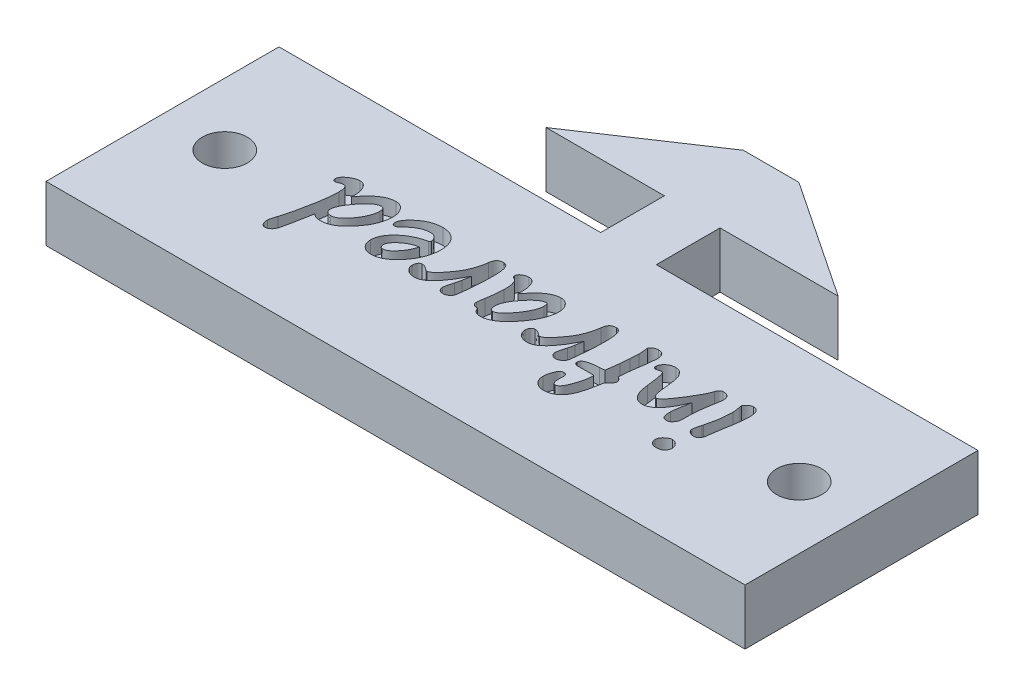
from build123d import *

# Parameters (mm, degrees)
BOSS_EXTRUDE1_DEPTH = 3.5814
SKETCH2_R           = 1.45
CUT_EXTRUDE1_DEPTH  = 29.456614801
CUT_EXTRUDE3_DEPTH  = 1


with BuildPart() as part:
    # Sketch1 → Boss-Extrude1 (new body)
    with BuildSketch(Plane(origin=(0, 0, 0), x_dir=(1, 0, 0), z_dir=(0, 1, 0))):
        Polygon((-22.5, -17.05), (22.5, -17.05), (22.5, -2.05), (1.7907, -2.05), (1.7907, 2.05), (9.398, 2.05), (1.7907, 7.13), (-1.7907, 7.13), (-9.398, 2.05), (-1.7907, 2.05), (-1.7907, -2.05), (-22.5, -2.05), align=None)
    extrude(amount=BOSS_EXTRUDE1_DEPTH)

    # Sketch2 → Cut-Extrude1 (cut, through all)
    with BuildSketch(Plane(origin=(0, 3.5814, 0), x_dir=(1, 0, 0), z_dir=(0, 1, 0))):
        with Locations(Location((-18.49, -9.55, 0), (0, 0, 270))):
            Circle(SKETCH2_R)
        with Locations(Location((18.49, -9.55, 0), (0, 0, 270))):
            Circle(SKETCH2_R)
    extrude(amount=-CUT_EXTRUDE1_DEPTH, mode=Mode.SUBTRACT)

    # infraredText → Cut-Extrude3 (cut)
    # profile 1 of 9: a face of its own
    with BuildSketch(Plane(origin=(0, 3.5814, 0), x_dir=(1, 0, 0), z_dir=(0, 1, 0))):
        with BuildLine():
            add(Edge.make_bspline(
                [(-11.806110015, -8.070633535), (-11.771150194, -8.023362866), (-11.702854527, -7.93101737), (-11.598127027, -7.798755117), (-11.492202987, -7.676748346), (-11.386490875, -7.563620089), (-11.282128049, -7.458022875), (-11.176053303, -7.363116004), (-11.07028154, -7.276144398), (-10.964409634, -7.198366878), (-10.857618181, -7.131022331), (-10.752364393, -7.070920318), (-10.646197147, -7.020465267), (-10.539597929, -6.980511925), (-10.433149615, -6.948227767), (-10.326862261, -6.9251547), (-10.220122375, -6.911240358), (-10.149026068, -6.909244173), (-10.11344185, -6.908245068)],
                knots=[0, 0, 0, 0, 1.324976436, 2.588404326, 3.800907731, 4.96509339, 6.077533696, 7.145523712, 8.171201392, 9.16285322, 10.103788344, 11.015030626, 11.893091768, 12.749564708, 13.578348318, 14.397906085, 15.198140357, 16, 16, 16, 16], degree=3))
            add(Edge.make_bspline(
                [(-10.11344185, -6.908245068), (-10.085516258, -6.908771632), (-10.030601187, -6.909807109), (-9.950535476, -6.924279286), (-9.873973719, -6.944989114), (-9.801643126, -6.97492826), (-9.733705417, -7.013500855), (-9.671186878, -7.061766096), (-9.610606933, -7.116135272), (-9.557217199, -7.181003042), (-9.506432574, -7.250352929), (-9.465037113, -7.326958039), (-9.428064309, -7.406609037), (-9.398031153, -7.491135448), (-9.375070335, -7.580545352), (-9.359375038, -7.674753608), (-9.347843503, -7.773189748), (-9.347180428, -7.840361621), (-9.346841852, -7.874660604)],
                knots=[0, 0, 0, 0, 0.969388154, 1.906280828, 2.819060712, 3.722358151, 4.61973858, 5.525774951, 6.46319642, 7.442312715, 8.439918134, 9.4464254, 10.46248833, 11.490491446, 12.559553965, 13.666646494, 14.808554106, 16, 16, 16, 16], degree=3))
            add(Edge.make_bspline(
                [(-9.346841852, -7.874660604), (-9.348813298, -7.945872655), (-9.352767966, -8.08872214), (-9.387053324, -8.302433097), (-9.442155863, -8.51552078), (-9.518834411, -8.728468503), (-9.615860488, -8.94173396), (-9.737425958, -9.153113673), (-9.878808141, -9.364748236), (-10.038945548, -9.571226003), (-10.208566694, -9.765749367), (-10.383401046, -9.937576011), (-10.559143824, -10.083008898), (-10.73476902, -10.203198883), (-10.911720728, -10.297153625), (-11.090060217, -10.362938909), (-11.269118933, -10.404545897), (-11.389294362, -10.410002638), (-11.44874761, -10.412702199)],
                knots=[0, 0, 0, 0, 0.958699336, 1.92312542, 2.907531197, 3.919813922, 4.967853069, 6.059222458, 7.200454383, 8.393590881, 9.576352525, 10.674375138, 11.691626039, 12.645071656, 13.536397169, 14.382483164, 15.199781262, 16, 16, 16, 16], degree=3))
            add(Edge.make_bspline(
                [(-11.44874761, -10.412702199), (-11.481752109, -10.412255668), (-11.54535286, -10.411395187), (-11.636989841, -10.401866208), (-11.721077206, -10.385307405), (-11.798323419, -10.363875416), (-11.867819206, -10.334801922), (-11.930145811, -10.300288302), (-11.985054707, -10.258644145), (-12.015663246, -10.225530524), (-12.030902495, -10.209044055)],
                knots=[0, 0, 0, 0, 1.244307737, 2.397821757, 3.468262062, 4.473437161, 5.415329021, 6.302038564, 7.154626184, 8, 8, 8, 8], degree=3))
            add(Edge.make_bspline(
                [(-12.030902495, -10.209044055), (-12.048230694, -10.294534564), (-12.081190417, -10.457144867), (-12.127521984, -10.688620678), (-12.167213494, -10.895030974), (-12.20385604, -11.075940831), (-12.231833648, -11.231850455), (-12.256018665, -11.362461821), (-12.275929581, -11.467270988), (-12.285298272, -11.529275457), (-12.289317783, -11.555877634)],
                knots=[0, 0, 0, 0, 1.526449126, 2.903437537, 4.130980214, 5.20466225, 6.133387332, 6.902732848, 7.529232388, 8, 8, 8, 8], degree=3))
            add(Edge.make_bspline(
                [(-12.289317783, -11.555877634), (-12.297330356, -11.595903142), (-12.31259127, -11.67213655), (-12.334374243, -11.781532658), (-12.356422879, -11.880122552), (-12.377956429, -11.968325493), (-12.396277354, -12.046558345), (-12.416192996, -12.113442373), (-12.43258202, -12.170660218), (-12.455697771, -12.231249129), (-12.485523776, -12.297347972), (-12.53118336, -12.366429928), (-12.585775441, -12.425978792), (-12.647454546, -12.474668514), (-12.710483262, -12.513286405), (-12.770422943, -12.54139891), (-12.825783605, -12.560757872), (-12.862054381, -12.56334288), (-12.879157881, -12.564561842)],
                knots=[0, 0, 0, 0, 1.553536891, 2.958898393, 4.245068746, 5.39787912, 6.414667805, 7.301890869, 8.05363876, 8.678390636, 9.768764809, 10.806445872, 11.815610368, 12.830059252, 13.787335911, 14.621496536, 15.349966074, 16, 16, 16, 16], degree=3))
            add(Edge.make_bspline(
                [(-12.879157881, -12.564561842), (-12.905341937, -12.563068149), (-12.955930801, -12.560182262), (-13.026784985, -12.532876541), (-13.087363367, -12.487988858), (-13.135990793, -12.426035661), (-13.173816032, -12.35204176), (-13.200586499, -12.267930318), (-13.216993441, -12.175172979), (-13.219097384, -12.110244777), (-13.220189208, -12.076550816)],
                knots=[0, 0, 0, 0, 0.93919978, 1.814579444, 2.688136663, 3.622232059, 4.62217955, 5.664461456, 6.787991285, 8, 8, 8, 8], degree=3))
            add(Edge.make_bspline(
                [(-13.220189208, -12.076550816), (-13.219751995, -12.06692145), (-13.218709953, -12.043971093), (-13.210863192, -12.004676468), (-13.200429379, -11.95471565), (-13.185903124, -11.893783264), (-13.166395145, -11.822211264), (-13.143636471, -11.739410373), (-13.115227984, -11.646156365), (-13.095291454, -11.580217562), (-13.084737329, -11.545310466)],
                knots=[0, 0, 0, 0, 0.420801042, 1.002925227, 1.746803402, 2.653176078, 3.73952945, 4.989144469, 6.406094463, 8, 8, 8, 8], degree=3))
            add(Edge.make_bspline(
                [(-13.084737329, -11.545310466), (-13.066342324, -11.484512199), (-13.028662255, -11.359973883), (-12.973605936, -11.168070102), (-12.921338566, -10.966383276), (-12.869235408, -10.755716725), (-12.818577965, -10.535966284), (-12.768492501, -10.307021886), (-12.719660795, -10.068731139), (-12.67209151, -9.824799279), (-12.628965782, -9.582246241), (-12.588854252, -9.349326528), (-12.556505605, -9.128883543), (-12.528964073, -8.921772363), (-12.509353066, -8.727225543), (-12.49316215, -8.545732063), (-12.484352227, -8.376850974), (-12.483038191, -8.268536133), (-12.482408759, -8.216652583)],
                knots=[0, 0, 0, 0, 0.898980173, 1.841458341, 2.825263159, 3.847482305, 4.91272706, 6.016770872, 7.164208838, 8.355201615, 9.533956712, 10.650781139, 11.699969597, 12.687056986, 13.607440684, 14.467039357, 15.265701345, 16, 16, 16, 16], degree=3))
            add(Edge.make_bspline(
                [(-12.482408759, -8.216652583), (-12.483005189, -8.172106444), (-12.484123143, -8.088608627), (-12.495771947, -7.972403457), (-12.512680871, -7.873112246), (-12.53896284, -7.79203335), (-12.572608916, -7.727348026), (-12.61519447, -7.680564933), (-12.667156654, -7.650365468), (-12.705219208, -7.647484403), (-12.724492969, -7.646025517)],
                knots=[0, 0, 0, 0, 1.570962073, 2.944630182, 4.116766624, 5.117064123, 5.9411411, 6.668474312, 7.325754419, 8, 8, 8, 8], degree=3))
            add(Edge.make_bspline(
                [(-12.724492969, -7.646025517), (-12.745673338, -7.646811231), (-12.788972507, -7.648417473), (-12.854792674, -7.660456618), (-12.922293839, -7.680840607), (-12.966740293, -7.69970979), (-12.989632818, -7.709428524)],
                knots=[0, 0, 0, 0, 0.925175566, 1.89134257, 2.913918031, 4, 4, 4, 4], degree=3))
            add(Edge.make_bspline(
                [(-12.989632818, -7.709428524), (-13.011312861, -7.718345995), (-13.05051594, -7.73447107), (-13.105069036, -7.752768744), (-13.148837317, -7.7657778), (-13.175302259, -7.768030233), (-13.186566401, -7.768988925)],
                knots=[0, 0, 0, 0, 1.360770826, 2.460622662, 3.344802459, 4, 4, 4, 4], degree=3))
            add(Edge.make_bspline(
                [(-13.186566401, -7.768988925), (-13.198797534, -7.768511456), (-13.22200423, -7.767605531), (-13.254426065, -7.758791584), (-13.28260791, -7.744313228), (-13.304721924, -7.722399989), (-13.322544747, -7.695686152), (-13.335301959, -7.663015027), (-13.341106505, -7.624451858), (-13.342447158, -7.59704444), (-13.343152616, -7.582622509)],
                knots=[0, 0, 0, 0, 1.053201094, 1.998287302, 2.875942799, 3.75533623, 4.65192373, 5.631907346, 6.753896922, 8, 8, 8, 8], degree=3))
            add(Edge.make_bspline(
                [(-13.343152616, -7.582622509), (-13.342321512, -7.563612321), (-13.3406459, -7.525285351), (-13.323604784, -7.468462685), (-13.298738955, -7.41130624), (-13.262600877, -7.354747468), (-13.216765102, -7.298756347), (-13.161193924, -7.242804116), (-13.096084521, -7.186071213), (-12.996766773, -7.114505906), (-12.869297981, -7.034480036), (-12.714172492, -6.961496613), (-12.561296591, -6.917816768), (-12.460240273, -6.9113672), (-12.411320539, -6.908245068)],
                knots=[0, 0, 0, 0, 0.55329444, 1.115512297, 1.717989145, 2.368749697, 3.066331064, 3.826219108, 4.667472561, 5.583269178, 7.395909717, 9.051658431, 10.57275539, 12, 12, 12, 12], degree=3))
            add(Edge.make_bspline(
                [(-12.411320539, -6.908245068), (-12.386241239, -6.908963272), (-12.33679898, -6.910379166), (-12.265349296, -6.927720068), (-12.197882592, -6.953755538), (-12.134562961, -6.990565111), (-12.077020446, -7.039427729), (-12.023658949, -7.097990691), (-11.974480966, -7.166568543), (-11.931276933, -7.245397391), (-11.891729975, -7.330788827), (-11.860624833, -7.422847052), (-11.834310999, -7.518975447), (-11.815323088, -7.620180027), (-11.80278299, -7.726102452), (-11.797649162, -7.836796678), (-11.796798108, -7.952301228), (-11.802962016, -8.030629915), (-11.806110015, -8.070633535)],
                knots=[0, 0, 0, 0, 0.819758064, 1.616101291, 2.393219002, 3.182903956, 4.002057948, 4.855734939, 5.772597315, 6.758710504, 7.795981571, 8.850762113, 9.93713835, 11.058198046, 12.219928082, 13.427710693, 14.686293749, 16, 16, 16, 16], degree=3))
        make_face()
        with BuildLine():
            add(Edge.make_bspline(
                [(-11.430495229, -9.797885159), (-11.394767892, -9.795614586), (-11.321818285, -9.790978432), (-11.212439127, -9.75956455), (-11.103077199, -9.707073227), (-10.992331572, -9.63545877), (-10.881584063, -9.542492422), (-10.769287875, -9.430266331), (-10.654950209, -9.298598118), (-10.544030804, -9.149151247), (-10.437230446, -8.993194471), (-10.34443138, -8.835009788), (-10.263617063, -8.681785756), (-10.199281791, -8.530864389), (-10.147274143, -8.38422644), (-10.112178017, -8.239963691), (-10.08820273, -8.099616689), (-10.085800234, -8.006683815), (-10.084622301, -7.96111925)],
                knots=[0, 0, 0, 0, 0.705379144, 1.440273328, 2.22955745, 3.094346001, 4.037630123, 5.079521489, 6.227076151, 7.477924592, 8.75304302, 9.957970022, 11.097814732, 12.171463362, 13.195409933, 14.166271496, 15.100931247, 16, 16, 16, 16], degree=3))
            add(Edge.make_bspline(
                [(-10.084622301, -7.96111925), (-10.08536663, -7.936426123), (-10.086766408, -7.889988437), (-10.096751293, -7.825155873), (-10.114779841, -7.769919589), (-10.141001886, -7.724712008), (-10.17446373, -7.688570313), (-10.215908256, -7.663065676), (-10.264904844, -7.648356907), (-10.299703127, -7.646830669), (-10.318060646, -7.646025517)],
                knots=[0, 0, 0, 0, 1.326939189, 2.495430678, 3.513138019, 4.431082101, 5.283269924, 6.1333699, 7.015276214, 8, 8, 8, 8], degree=3))
            add(Edge.make_bspline(
                [(-10.318060646, -7.646025517), (-10.351947081, -7.648084308), (-10.422884517, -7.652394157), (-10.529540318, -7.689623218), (-10.640923648, -7.744946419), (-10.756376671, -7.823363208), (-10.876450334, -7.923224506), (-11.001178331, -8.045095746), (-11.130685988, -8.188831403), (-11.260681695, -8.349445706), (-11.38504281, -8.515976611), (-11.497132275, -8.677913535), (-11.591174585, -8.831353957), (-11.669155806, -8.974882448), (-11.729688583, -9.109593611), (-11.771940381, -9.235752592), (-11.800405435, -9.352489133), (-11.804277657, -9.427895615), (-11.806110015, -9.463578393)],
                knots=[0, 0, 0, 0, 0.657273412, 1.375927919, 2.175000218, 3.072880042, 4.081247454, 5.208352828, 6.460100899, 7.840798174, 9.224145718, 10.500287903, 11.6683947, 12.721270525, 13.674510839, 14.534848866, 15.306682107, 16, 16, 16, 16], degree=3))
            add(Edge.make_bspline(
                [(-11.806110015, -9.463578393), (-11.804771976, -9.4839102), (-11.802098898, -9.524528221), (-11.781353957, -9.584076821), (-11.748172886, -9.640857631), (-11.703304735, -9.694072492), (-11.648313271, -9.74080069), (-11.582248146, -9.773332234), (-11.508958064, -9.794492874), (-11.457228293, -9.796729374), (-11.430495229, -9.797885159)],
                knots=[0, 0, 0, 0, 0.87516286, 1.748363225, 2.68852472, 3.69791186, 4.737350443, 5.77467793, 6.849991473, 8, 8, 8, 8], degree=3))
        make_face(mode=Mode.SUBTRACT)
    # profile 2 of 9: a face of its own
    with BuildSketch(Plane(origin=(0, 3.5814, 0), x_dir=(1, 0, 0), z_dir=(0, 1, 0))):
        with BuildLine():
            add(Edge.make_bspline(
                [(-8.977951628, -8.107138297), (-8.976227075, -8.078444662), (-8.972630106, -8.018597212), (-8.943166978, -7.928309176), (-8.898029165, -7.834481662), (-8.836167649, -7.736215713), (-8.754889499, -7.635498256), (-8.657388302, -7.52989721), (-8.54305139, -7.419306926), (-8.412609347, -7.308614326), (-8.272566501, -7.200494236), (-8.123447174, -7.107045582), (-7.970727482, -7.025949554), (-7.812942862, -6.960913671), (-7.65041074, -6.90939106), (-7.483538999, -6.873042498), (-7.31178336, -6.851513319), (-7.196003616, -6.848360672), (-7.137343113, -6.846763364)],
                knots=[0, 0, 0, 0, 0.57554803, 1.200443268, 1.891164434, 2.665922844, 3.527072402, 4.487897783, 5.552645211, 6.720875868, 7.92405451, 9.103938409, 10.252243972, 11.394531414, 12.527960044, 13.673865764, 14.821450097, 16, 16, 16, 16], degree=3))
            add(Edge.make_bspline(
                [(-7.137343113, -6.846763364), (-7.0931031, -6.847896594), (-7.006554963, -6.850113567), (-6.880447611, -6.866637815), (-6.761456435, -6.893615995), (-6.649507323, -6.930373785), (-6.545658654, -6.980606335), (-6.448343074, -7.039884708), (-6.358095377, -7.110535644), (-6.276933489, -7.192439041), (-6.203268548, -7.283339051), (-6.138931773, -7.383082139), (-6.085259772, -7.491586948), (-6.040232865, -7.60775963), (-6.007632439, -7.733340577), (-5.9822536, -7.866756027), (-5.967998643, -8.008842367), (-5.96624761, -8.106147334), (-5.965348129, -8.15613153)],
                knots=[0, 0, 0, 0, 1.066413057, 2.086257618, 3.060152985, 4.004972127, 4.920084507, 5.835034041, 6.747798638, 7.67584611, 8.609081286, 9.564190282, 10.530929413, 11.523105385, 12.562487588, 13.654226254, 14.795008941, 16, 16, 16, 16], degree=3))
            add(Edge.make_bspline(
                [(-5.965348129, -8.15613153), (-5.966981982, -8.231500751), (-5.970235748, -8.381596168), (-6.00308922, -8.604517653), (-6.051826864, -8.824243938), (-6.124744584, -9.039613337), (-6.214440453, -9.252184733), (-6.326054259, -9.460918347), (-6.458259405, -9.665258145), (-6.606788718, -9.863112113), (-6.766628671, -10.0468006), (-6.931249656, -10.210382761), (-7.100472587, -10.347704764), (-7.271312793, -10.461377385), (-7.446226295, -10.549127537), (-7.623599768, -10.611912269), (-7.804221329, -10.651445203), (-7.925843778, -10.656236929), (-7.98655915, -10.658629016)],
                knots=[0, 0, 0, 0, 1.031231157, 2.05366421, 3.078941494, 4.109053673, 5.161976755, 6.234828808, 7.34516123, 8.491204526, 9.619218471, 10.676404711, 11.664457494, 12.598343919, 13.480657219, 14.336215279, 15.169418901, 16, 16, 16, 16], degree=3))
            add(Edge.make_bspline(
                [(-7.98655915, -10.658629016), (-8.016045305, -10.657819098), (-8.07392827, -10.656229185), (-8.158630141, -10.645881346), (-8.238897344, -10.627221466), (-8.315134034, -10.602646217), (-8.386763715, -10.569823906), (-8.453312661, -10.528848833), (-8.515984015, -10.481858745), (-8.573607342, -10.428046362), (-8.624890489, -10.368731142), (-8.67014791, -10.306525639), (-8.708391807, -10.241288953), (-8.738446897, -10.172943013), (-8.764449979, -10.102397629), (-8.78135669, -10.028476557), (-8.79089459, -9.951839561), (-8.792627064, -9.900060901), (-8.793506516, -9.873776637)],
                knots=[0, 0, 0, 0, 1.123949543, 2.206375635, 3.245620512, 4.260718056, 5.254683183, 6.24059744, 7.234112844, 8.235841109, 9.239352339, 10.2183675, 11.164574431, 12.115101067, 13.06091432, 14.026060516, 14.997974354, 16, 16, 16, 16], degree=3))
            add(Edge.make_bspline(
                [(-8.793506516, -9.873776637), (-8.791740503, -9.826603125), (-8.788196226, -9.731928825), (-8.762547819, -9.591179995), (-8.719648002, -9.452353582), (-8.659502013, -9.315693879), (-8.582763131, -9.18034593), (-8.489474695, -9.046610456), (-8.377578355, -8.916033876), (-8.251909659, -8.787152321), (-8.112478371, -8.664282162), (-7.96253411, -8.549546526), (-7.802250228, -8.445821914), (-7.633026188, -8.351318138), (-7.453627734, -8.267843582), (-7.265157016, -8.194262932), (-7.067598062, -8.128740513), (-6.931064847, -8.095315674), (-6.861636096, -8.078318748)],
                knots=[0, 0, 0, 0, 0.800803191, 1.607162089, 2.420693954, 3.263201909, 4.13728089, 5.058926231, 6.02735895, 7.054002529, 8.113358597, 9.180223585, 10.257060199, 11.352407999, 12.468942304, 13.613976215, 14.786678748, 16, 16, 16, 16], degree=3))
            add(Edge.make_bspline(
                [(-6.861636096, -8.078318748), (-6.847126057, -8.073779508), (-6.819932842, -8.065272533), (-6.786915524, -8.039109971), (-6.767011554, -8.002669965), (-6.76543922, -7.975462884), (-6.764610282, -7.96111925)],
                knots=[0, 0, 0, 0, 1.092953599, 2.048300673, 2.971059712, 4, 4, 4, 4], degree=3))
            add(Edge.make_bspline(
                [(-6.764610282, -7.96111925), (-6.7663779, -7.935311081), (-6.769950784, -7.88314509), (-6.796626051, -7.80600834), (-6.840928935, -7.732079496), (-6.899870058, -7.661602303), (-6.972930149, -7.599636602), (-7.060414538, -7.555271765), (-7.158992588, -7.527044612), (-7.228719553, -7.524427808), (-7.265109779, -7.523062109)],
                knots=[0, 0, 0, 0, 0.840820492, 1.699548494, 2.631031788, 3.639332869, 4.685074668, 5.731442161, 6.816048695, 8, 8, 8, 8], degree=3))
            add(Edge.make_bspline(
                [(-7.265109779, -7.523062109), (-7.318745124, -7.525103425), (-7.426934735, -7.529221032), (-7.588420914, -7.562957154), (-7.749989085, -7.614934574), (-7.910975412, -7.688762286), (-8.071163268, -7.784022281), (-8.230808554, -7.900271195), (-8.390567231, -8.036708024), (-8.491671323, -8.139632879), (-8.543737093, -8.192636292)],
                knots=[0, 0, 0, 0, 0.866839858, 1.74853109, 2.657591878, 3.607915725, 4.606351584, 5.667263571, 6.798706195, 8, 8, 8, 8], degree=3))
            add(Edge.make_bspline(
                [(-8.543737093, -8.192636292), (-8.563665042, -8.212212423), (-8.600737218, -8.24863011), (-8.661761265, -8.290295042), (-8.722446022, -8.317674605), (-8.764125867, -8.320828135), (-8.7839, -8.322324261)],
                knots=[0, 0, 0, 0, 1.194008747, 2.22122733, 3.156098407, 4, 4, 4, 4], degree=3))
            add(Edge.make_bspline(
                [(-8.7839, -8.322324261), (-8.798990762, -8.321483601), (-8.827582903, -8.319890819), (-8.868137315, -8.310768092), (-8.902216299, -8.293201201), (-8.930542645, -8.268933857), (-8.952897654, -8.238195922), (-8.966876637, -8.19959504), (-8.97685876, -8.155684879), (-8.977575267, -8.123856739), (-8.977951628, -8.107138297)],
                knots=[0, 0, 0, 0, 1.09370073, 2.072211148, 2.984766472, 3.83983899, 4.753571805, 5.700815368, 6.792301877, 8, 8, 8, 8], degree=3))
        make_face()
        with BuildLine():
            add(Edge.make_bspline(
                [(-6.822249379, -8.680647318), (-6.86465107, -8.690044971), (-6.948507511, -8.708630404), (-7.07139248, -8.745652231), (-7.190094587, -8.789634857), (-7.305314875, -8.840928923), (-7.416779264, -8.899457926), (-7.524251761, -8.96566634), (-7.627401949, -9.039448449), (-7.725968169, -9.117540447), (-7.815745308, -9.19943036), (-7.89631739, -9.279651156), (-7.963448422, -9.359309007), (-8.018941167, -9.43659098), (-8.06295445, -9.511521259), (-8.094340824, -9.585312033), (-8.113732245, -9.65759101), (-8.116075996, -9.705556258), (-8.117207771, -9.728718242)],
                knots=[0, 0, 0, 0, 1.183709009, 2.340982726, 3.495586228, 4.632831282, 5.776991368, 6.925406583, 8.071164194, 9.232776225, 10.351474417, 11.382388316, 12.330264518, 13.187804325, 13.973938698, 14.693831104, 15.369262885, 16, 16, 16, 16], degree=3))
            add(Edge.make_bspline(
                [(-8.117207771, -9.728718242), (-8.116564858, -9.746092326), (-8.115322961, -9.779653317), (-8.103024784, -9.827535002), (-8.085101395, -9.87145309), (-8.05905252, -9.910147401), (-8.026509099, -9.941666341), (-7.989497309, -9.965603675), (-7.947485921, -9.979612945), (-7.918136857, -9.981404962), (-7.902982459, -9.982330271)],
                knots=[0, 0, 0, 0, 1.123502494, 2.170235578, 3.183743803, 4.185072822, 5.168178559, 6.100719146, 7.01930572, 8, 8, 8, 8], degree=3))
            add(Edge.make_bspline(
                [(-7.902982459, -9.982330271), (-7.878845143, -9.98092039), (-7.829525379, -9.978039581), (-7.755008987, -9.957311881), (-7.679261342, -9.924374715), (-7.601614285, -9.87801635), (-7.521897389, -9.819441485), (-7.441530492, -9.746119735), (-7.357863833, -9.662007201), (-7.274968036, -9.565709474), (-7.193609696, -9.463244375), (-7.11851786, -9.356452774), (-7.051135731, -9.247543312), (-6.990854413, -9.137084432), (-6.936436918, -9.025997324), (-6.891311907, -8.912416713), (-6.852697134, -8.797608132), (-6.832369802, -8.719523513), (-6.822249379, -8.680647318)],
                knots=[0, 0, 0, 0, 0.65097919, 1.330145421, 2.07342166, 2.875282111, 3.765466824, 4.738660306, 5.808090844, 6.965785881, 8.165677898, 9.338117153, 10.486874827, 11.62008614, 12.733282582, 13.8229493, 14.916106027, 16, 16, 16, 16], degree=3))
        make_face(mode=Mode.SUBTRACT)
    # profile 3 of 9: a face of its own
    with BuildSketch(Plane(origin=(0, 3.5814, 0), x_dir=(1, 0, 0), z_dir=(0, 1, 0))):
        with BuildLine():
            Line((-3.514725831, -8.648945814), (-3.570443626, -8.753656841))
            add(Edge.make_bspline(
                [(-3.570443626, -8.753656841), (-3.603070253, -8.818205732), (-3.66730964, -8.945297666), (-3.768149233, -9.129551445), (-3.870828039, -9.304572767), (-3.975732442, -9.470138316), (-4.082236134, -9.626386785), (-4.189571649, -9.774211251), (-4.300500265, -9.911511823), (-4.411857614, -10.039479886), (-4.522968894, -10.156186932), (-4.636161069, -10.25607915), (-4.746955765, -10.34258623), (-4.858567768, -10.412229963), (-4.968777978, -10.467999489), (-5.079270879, -10.506545015), (-5.188700557, -10.53108836), (-5.261709299, -10.534154372), (-5.297695249, -10.535665608)],
                knots=[0, 0, 0, 0, 1.342684811, 2.643645873, 3.898757482, 5.109320073, 6.281691933, 7.408925678, 8.499847849, 9.557393111, 10.558014314, 11.488637284, 12.357837434, 13.164443554, 13.927481165, 14.645710834, 15.332471959, 16, 16, 16, 16], degree=3))
            add(Edge.make_bspline(
                [(-5.297695249, -10.535665608), (-5.350739686, -10.533620323), (-5.452546941, -10.529694845), (-5.59751856, -10.495037047), (-5.727908453, -10.439460251), (-5.839621054, -10.360409273), (-5.931173935, -10.267004406), (-5.998769808, -10.162465617), (-6.039014559, -10.0479007), (-6.044325617, -9.96854559), (-6.047003517, -9.92853378)],
                knots=[0, 0, 0, 0, 1.185657491, 2.2756116, 3.315500111, 4.339460608, 5.317653621, 6.226265179, 7.105661386, 8, 8, 8, 8], degree=3))
            add(Edge.make_bspline(
                [(-6.047003517, -9.92853378), (-6.046074414, -9.903491909), (-6.044273404, -9.854949768), (-6.030572097, -9.7850841), (-6.008460777, -9.720912862), (-5.977956962, -9.663134879), (-5.939686839, -9.613679528), (-5.891883983, -9.577886025), (-5.837233933, -9.555190105), (-5.798097301, -9.553054078), (-5.778021062, -9.551958343)],
                knots=[0, 0, 0, 0, 1.165548541, 2.259344817, 3.301608454, 4.31564642, 5.291463991, 6.186203372, 7.06956186, 8, 8, 8, 8], degree=3))
            add(Edge.make_bspline(
                [(-5.778021062, -9.551958343), (-5.74514744, -9.553842235), (-5.67949265, -9.557604721), (-5.58409327, -9.587131447), (-5.492555876, -9.633406927), (-5.439398536, -9.677924606), (-5.412012793, -9.700859345)],
                knots=[0, 0, 0, 0, 0.974791098, 1.946840685, 2.942247803, 4, 4, 4, 4], degree=3))
            add(Edge.make_bspline(
                [(-5.412012793, -9.700859345), (-5.39367262, -9.715292284), (-5.360164756, -9.741661554), (-5.311169078, -9.773013318), (-5.267553798, -9.793688278), (-5.239253057, -9.796588991), (-5.226607029, -9.797885159)],
                knots=[0, 0, 0, 0, 1.315793817, 2.403981766, 3.286828117, 4, 4, 4, 4], degree=3))
            add(Edge.make_bspline(
                [(-5.226607029, -9.797885159), (-5.204173958, -9.795234505), (-5.153798627, -9.789282241), (-5.077085761, -9.748631527), (-4.991036205, -9.688527184), (-4.894856709, -9.604311638), (-4.788869766, -9.497060546), (-4.671615387, -9.366842599), (-4.544240923, -9.212893953), (-4.409709574, -9.038976987), (-4.275361769, -8.851068879), (-4.155062344, -8.651628602), (-4.046305144, -8.447580299), (-3.953560822, -8.237050397), (-3.874078736, -8.020931735), (-3.810009831, -7.798719874), (-3.759471255, -7.570554608), (-3.737253469, -7.415639526), (-3.726069189, -7.337656345)],
                knots=[0, 0, 0, 0, 0.359936354, 0.808267114, 1.369936955, 2.047782751, 2.85454243, 3.78968804, 4.858976758, 6.060678337, 7.318302086, 8.563727491, 9.795966087, 11.026939385, 12.25285998, 13.48897217, 14.735965961, 16, 16, 16, 16], degree=3))
            add(Edge.make_bspline(
                [(-3.726069189, -7.337656345), (-3.719180169, -7.295459219), (-3.706312462, -7.216641001), (-3.67183939, -7.109631632), (-3.627576103, -7.021858251), (-3.569565302, -6.95418494), (-3.499929449, -6.905449836), (-3.420733454, -6.870324593), (-3.330311362, -6.850145369), (-3.266661366, -6.847927437), (-3.233254905, -6.846763364)],
                knots=[0, 0, 0, 0, 1.314523692, 2.455342948, 3.447393942, 4.32086209, 5.168763063, 6.042453637, 6.97258917, 8, 8, 8, 8], degree=3))
            add(Edge.make_bspline(
                [(-3.233254905, -6.846763364), (-3.215236494, -6.847365052), (-3.180015596, -6.848541182), (-3.129440413, -6.861780891), (-3.082766725, -6.881746918), (-3.040366536, -6.910719173), (-3.002031939, -6.947291487), (-2.967810639, -6.992276402), (-2.939712345, -7.046049919), (-2.913313745, -7.106847031), (-2.891521888, -7.177158293), (-2.872462162, -7.257087238), (-2.856575927, -7.347265016), (-2.842730217, -7.447836092), (-2.83426547, -7.558538157), (-2.825715123, -7.679530467), (-2.822754855, -7.810605457), (-2.821687657, -7.901559848), (-2.821135357, -7.948630779)],
                knots=[0, 0, 0, 0, 0.667695719, 1.30515625, 1.928254686, 2.545079203, 3.201236271, 3.888658743, 4.63374288, 5.448901252, 6.347814124, 7.363172749, 8.499234462, 9.747245966, 11.131931857, 12.621578008, 14.251591078, 16, 16, 16, 16], degree=3))
            add(Edge.make_bspline(
                [(-2.821135357, -7.948630779), (-2.821420754, -7.991860332), (-2.822040189, -8.085687138), (-2.823830901, -8.236840631), (-2.827813519, -8.409442117), (-2.831610533, -8.531428805), (-2.833623829, -8.596109975)],
                knots=[0, 0, 0, 0, 0.801030489, 1.738582223, 2.800925325, 4, 4, 4, 4], degree=3))
            add(Edge.make_bspline(
                [(-2.833623829, -8.596109975), (-2.836545443, -8.663690657), (-2.842711067, -8.806309406), (-2.858341418, -9.030846911), (-2.880722633, -9.276758842), (-2.899021778, -9.447592633), (-2.908554655, -9.536587917)],
                knots=[0, 0, 0, 0, 0.860152397, 1.815220788, 2.86184668, 4, 4, 4, 4], degree=3))
            add(Edge.make_bspline(
                [(-2.908554655, -9.536587917), (-2.911264997, -9.559308017), (-2.91637598, -9.602152087), (-2.921349423, -9.662819884), (-2.927877735, -9.715516191), (-2.930433913, -9.748241258), (-2.931610294, -9.7633017)],
                knots=[0, 0, 0, 0, 1.204723067, 2.271787423, 3.204657188, 4, 4, 4, 4], degree=3))
            add(Edge.make_bspline(
                [(-2.931610294, -9.7633017), (-2.93659839, -9.812625392), (-2.945742331, -9.903043244), (-2.960086027, -10.02631628), (-2.977350802, -10.124382388), (-2.994948664, -10.202330516), (-3.021318342, -10.266900134), (-3.06055631, -10.323946138), (-3.109873291, -10.380517506), (-3.171147862, -10.432135604), (-3.238967889, -10.47901221), (-3.31368653, -10.511555992), (-3.391986629, -10.531726047), (-3.44543822, -10.534342853), (-3.47245716, -10.535665608)],
                knots=[0, 0, 0, 0, 1.682642002, 3.084539472, 4.210178062, 5.061546709, 5.792195733, 6.560815297, 7.400168622, 8.332580935, 9.273002347, 10.187767302, 11.083944826, 12, 12, 12, 12], degree=3))
            add(Edge.make_bspline(
                [(-3.47245716, -10.535665608), (-3.500128876, -10.534466024), (-3.552693882, -10.532187303), (-3.626278902, -10.512672902), (-3.690074928, -10.480855053), (-3.740720181, -10.434845016), (-3.779614728, -10.382210194), (-3.808153982, -10.326376897), (-3.82652285, -10.268145567), (-3.828722727, -10.228066462), (-3.829819565, -10.208083403)],
                knots=[0, 0, 0, 0, 1.223382736, 2.323929554, 3.344879327, 4.349253011, 5.321901594, 6.228660125, 7.116826846, 8, 8, 8, 8], degree=3))
            add(Edge.make_bspline(
                [(-3.829819565, -10.208083403), (-3.829504828, -10.193323821), (-3.828796641, -10.16011337), (-3.819435337, -10.105882006), (-3.80984314, -10.040540923), (-3.792495729, -9.965562223), (-3.772871851, -9.879128646), (-3.746017156, -9.783212243), (-3.718060435, -9.675753357), (-3.695598226, -9.601516529), (-3.683800518, -9.56252551)],
                knots=[0, 0, 0, 0, 0.533465027, 1.200346636, 1.987009204, 2.923265203, 3.982746037, 5.194035958, 6.526238247, 8, 8, 8, 8], degree=3))
            add(Edge.make_bspline(
                [(-3.683800518, -9.56252551), (-3.675228537, -9.533132549), (-3.657348543, -9.4718228), (-3.634520702, -9.375023284), (-3.614711602, -9.269739477), (-3.60264269, -9.196861594), (-3.59638122, -9.159051828)],
                knots=[0, 0, 0, 0, 0.889120287, 1.854584907, 2.886937431, 4, 4, 4, 4], degree=3))
            Line((-3.59638122, -9.159051828), (-3.514725831, -8.648945814))
        make_face()
    # profile 4 of 9: a face of its own
    with BuildSketch(Plane(origin=(0, 3.5814, 0), x_dir=(1, 0, 0), z_dir=(0, 1, 0))):
        with BuildLine():
            add(Edge.make_bspline(
                [(-1.046811804, -8.129233285), (-1.011843628, -8.082285395), (-0.943385771, -7.990374629), (-0.838727352, -7.85895424), (-0.734957486, -7.7359362), (-0.630006655, -7.623570249), (-0.52772712, -7.517538176), (-0.423862218, -7.423350852), (-0.321694521, -7.336539015), (-0.218915622, -7.260201569), (-0.11737492, -7.191540353), (-0.01591694, -7.132551418), (0.084922645, -7.082649), (0.185082193, -7.040693713), (0.285359417, -7.008710291), (0.385440038, -6.98692334), (0.484705723, -6.972749441), (0.550706042, -6.970728363), (0.583414005, -6.969726772)],
                knots=[0, 0, 0, 0, 1.356023357, 2.654712406, 3.891393304, 5.083024518, 6.216069908, 7.302884312, 8.329608252, 9.320661259, 10.267066465, 11.16786372, 12.037043053, 12.871862459, 13.681246504, 14.471364928, 15.242450052, 16, 16, 16, 16], degree=3))
            add(Edge.make_bspline(
                [(0.583414005, -6.969726772), (0.607145609, -6.970527147), (0.653884787, -6.972103477), (0.722926027, -6.982785799), (0.789137969, -7.001274926), (0.853247388, -7.026052909), (0.9139238, -7.05954987), (0.973061116, -7.098664796), (1.028581182, -7.14658748), (1.082249231, -7.199632894), (1.130799205, -7.258875822), (1.173772385, -7.322665807), (1.208565584, -7.391163696), (1.239520476, -7.462553146), (1.260825953, -7.539002841), (1.277103089, -7.618923056), (1.288438198, -7.702704855), (1.289136991, -7.759984784), (1.28949295, -7.789162609)],
                knots=[0, 0, 0, 0, 0.945321612, 1.861802311, 2.774725229, 3.679591997, 4.59278223, 5.53032613, 6.49885814, 7.509081362, 8.53314226, 9.544974888, 10.566251385, 11.589676516, 12.639239866, 13.719966986, 14.838573882, 16, 16, 16, 16], degree=3))
            add(Edge.make_bspline(
                [(1.28949295, -7.789162609), (1.287403979, -7.861692494), (1.283172382, -8.008615221), (1.2437199, -8.230092647), (1.184840553, -8.455132749), (1.099520473, -8.683239604), (0.991736161, -8.914866485), (0.858988646, -9.149768599), (0.702608331, -9.38817494), (0.526940382, -9.624666605), (0.339999778, -9.84858945), (0.148258837, -10.047795731), (-0.045295888, -10.215529692), (-0.237791307, -10.355101631), (-0.432043393, -10.463352574), (-0.627399862, -10.540083056), (-0.823581212, -10.587797388), (-0.954978233, -10.5940549), (-1.019913559, -10.597147312)],
                knots=[0, 0, 0, 0, 0.889157593, 1.801153518, 2.75221318, 3.740403762, 4.784494359, 5.883889217, 7.047687113, 8.280557834, 9.496390193, 10.624411777, 11.668886676, 12.634834158, 13.536934594, 14.389083892, 15.203898528, 16, 16, 16, 16], degree=3))
            add(Edge.make_bspline(
                [(-1.019913559, -10.597147312), (-1.051706883, -10.596167629), (-1.112607373, -10.594291034), (-1.199726355, -10.576483821), (-1.278467878, -10.547899819), (-1.348793392, -10.506974425), (-1.410361604, -10.454251046), (-1.462421433, -10.389371952), (-1.507608618, -10.314079193), (-1.528080978, -10.257506077), (-1.538665437, -10.228257087)],
                knots=[0, 0, 0, 0, 1.109020399, 2.124341774, 3.090185179, 4.022232803, 4.950045201, 5.903576897, 6.916123743, 8, 8, 8, 8], degree=3))
            add(Edge.make_bspline(
                [(-1.538665437, -10.228257087), (-1.567534259, -10.22735682), (-1.621783408, -10.225665072), (-1.69778619, -10.21276948), (-1.76227451, -10.189775999), (-1.81613411, -10.157966506), (-1.857636974, -10.115415733), (-1.887307772, -10.063609461), (-1.904682239, -10.002627797), (-1.906566894, -9.959070774), (-1.907555661, -9.936218993)],
                knots=[0, 0, 0, 0, 1.290339358, 2.424754674, 3.43007345, 4.33600111, 5.196452301, 6.055831131, 6.980010171, 8, 8, 8, 8], degree=3))
            add(Edge.make_bspline(
                [(-1.907555661, -9.936218993), (-1.907321777, -9.923408026), (-1.906812604, -9.89551825), (-1.903972889, -9.849967402), (-1.897460514, -9.797584041), (-1.891563407, -9.737837622), (-1.880904346, -9.671453478), (-1.871238058, -9.597574413), (-1.857235007, -9.517004348), (-1.847366649, -9.461013448), (-1.842231351, -9.431876889)],
                knots=[0, 0, 0, 0, 0.604092695, 1.315123946, 2.150418371, 3.092416672, 4.145034518, 5.319352214, 6.605043841, 8, 8, 8, 8], degree=3))
            add(Edge.make_bspline(
                [(-1.842231351, -9.431876889), (-1.83271669, -9.376515357), (-1.81415008, -9.268484597), (-1.790893621, -9.110444631), (-1.768610172, -8.961120856), (-1.75329366, -8.820325542), (-1.73866416, -8.688217112), (-1.730888336, -8.564782075), (-1.724248533, -8.449840644), (-1.723480835, -8.376129772), (-1.723110549, -8.340576642)],
                knots=[0, 0, 0, 0, 1.226641548, 2.393629903, 3.488384352, 4.523183705, 5.486192705, 6.390462516, 7.223668181, 8, 8, 8, 8], degree=3))
            add(Edge.make_bspline(
                [(-1.723110549, -8.340576642), (-1.723242056, -8.306629088), (-1.723496437, -8.240962657), (-1.726911547, -8.146518854), (-1.729717396, -8.059929298), (-1.737392593, -7.981576755), (-1.743860056, -7.910847164), (-1.755175941, -7.848232122), (-1.765952585, -7.793159719), (-1.783674636, -7.73293315), (-1.805930839, -7.669893252), (-1.828854553, -7.605894122), (-1.846740619, -7.556540246), (-1.862526882, -7.518787733), (-1.884719023, -7.487681068), (-1.918197344, -7.459291645), (-1.965758892, -7.4320737), (-2.001896789, -7.414574963), (-2.021873205, -7.404901959)],
                knots=[0, 0, 0, 0, 1.567707045, 3.03249319, 4.364819913, 5.56719633, 6.667961304, 7.642916326, 8.504369449, 9.258029845, 10.539480395, 11.591998183, 12.396880242, 12.966017804, 13.474898024, 14.145479072, 14.974852361, 16, 16, 16, 16], degree=3))
            add(Edge.make_bspline(
                [(-2.021873205, -7.404901959), (-2.041712481, -7.394645434), (-2.078719419, -7.375513558), (-2.121916315, -7.334315993), (-2.148274524, -7.285514367), (-2.151739865, -7.250535233), (-2.153482477, -7.232945318)],
                knots=[0, 0, 0, 0, 1.165299696, 2.173676752, 3.081599004, 4, 4, 4, 4], degree=3))
            add(Edge.make_bspline(
                [(-2.153482477, -7.232945318), (-2.151537041, -7.206343113), (-2.147633843, -7.152970181), (-2.112421224, -7.077449359), (-2.055127229, -7.010965818), (-1.979725688, -6.954587632), (-1.894042503, -6.907573602), (-1.80348588, -6.8730723), (-1.711092867, -6.85035384), (-1.648628876, -6.847959116), (-1.61743887, -6.846763364)],
                knots=[0, 0, 0, 0, 0.878065885, 1.761694263, 2.703389782, 3.762676792, 4.86464712, 5.932934182, 6.967856617, 8, 8, 8, 8], degree=3))
            add(Edge.make_bspline(
                [(-1.61743887, -6.846763364), (-1.592057321, -6.847556949), (-1.542399834, -6.84910955), (-1.470823697, -6.865023392), (-1.404471992, -6.890272419), (-1.34309043, -6.925017684), (-1.287649494, -6.970970597), (-1.238726074, -7.027707802), (-1.194280712, -7.093348861), (-1.156016553, -7.168985305), (-1.123261487, -7.254280771), (-1.096867309, -7.3499662), (-1.075086177, -7.455580409), (-1.057755934, -7.570999351), (-1.046495586, -7.696412073), (-1.040947124, -7.831691417), (-1.041192625, -7.977177334), (-1.044895078, -8.077366355), (-1.046811804, -8.129233285)],
                knots=[0, 0, 0, 0, 0.77378412, 1.513862485, 2.225506092, 2.934796041, 3.656969267, 4.411939522, 5.214457123, 6.071333747, 6.993522075, 7.999225777, 9.097748638, 10.283892926, 11.56006836, 12.939615608, 14.415667293, 16, 16, 16, 16], degree=3))
        make_face()
        with BuildLine():
            add(Edge.make_bspline(
                [(-0.873894512, -9.920848567), (-0.845435302, -9.918300251), (-0.784835049, -9.912873939), (-0.692920102, -9.875596424), (-0.596014761, -9.818186681), (-0.493991031, -9.737444079), (-0.385369845, -9.635730801), (-0.270306159, -9.511622015), (-0.15094282, -9.363514885), (-0.027785657, -9.199225481), (0.091573461, -9.027505367), (0.197066452, -8.85672902), (0.287266043, -8.6932064), (0.360741446, -8.536400603), (0.418306984, -8.386259656), (0.458542759, -8.242496363), (0.485880377, -8.105614662), (0.488812551, -8.015994775), (0.490230797, -7.97264707)],
                knots=[0, 0, 0, 0, 0.547446736, 1.165717904, 1.886714498, 2.712774485, 3.663580999, 4.749572114, 5.967383271, 7.323450125, 8.701542305, 9.991323788, 11.185745275, 12.294312406, 13.322360815, 14.276577786, 15.166408265, 16, 16, 16, 16], degree=3))
            add(Edge.make_bspline(
                [(0.490230797, -7.97264707), (0.489795636, -7.951832704), (0.488984253, -7.913023142), (0.484866768, -7.858900586), (0.475821099, -7.813419209), (0.465650951, -7.775007779), (0.448556562, -7.746026162), (0.430604377, -7.723202369), (0.406874292, -7.70931217), (0.389529951, -7.708115369), (0.380716512, -7.707507221)],
                knots=[0, 0, 0, 0, 1.590105808, 2.9648422, 4.134947436, 5.132680352, 5.975817276, 6.686597827, 7.332601359, 8, 8, 8, 8], degree=3))
            add(Edge.make_bspline(
                [(0.380716512, -7.707507221), (0.347823671, -7.709709252), (0.279030004, -7.714314687), (0.174742921, -7.749092293), (0.065632432, -7.802857702), (-0.048727737, -7.877891152), (-0.168245446, -7.974161947), (-0.292363892, -8.092112145), (-0.423188258, -8.229978845), (-0.555534175, -8.384224041), (-0.682483136, -8.545995163), (-0.794785828, -8.707680962), (-0.892123957, -8.862925009), (-0.970039138, -9.014130047), (-1.031707315, -9.1597212), (-1.075105715, -9.30031279), (-1.102966198, -9.435901904), (-1.106549027, -9.524937796), (-1.108293508, -9.56828942)],
                knots=[0, 0, 0, 0, 0.626644589, 1.310594621, 2.078232344, 2.943997713, 3.913195093, 5.002161588, 6.207575212, 7.537260959, 8.877636289, 10.128138936, 11.291001266, 12.37008992, 13.369478603, 14.302668376, 15.173568294, 16, 16, 16, 16], degree=3))
            add(Edge.make_bspline(
                [(-1.108293508, -9.56828942), (-1.107418772, -9.59397995), (-1.105754301, -9.642864592), (-1.091998848, -9.712100664), (-1.070525601, -9.773729326), (-1.038672354, -9.825490089), (-1.001393316, -9.866751438), (-0.961404189, -9.897759992), (-0.91848664, -9.917504059), (-0.888487598, -9.919754053), (-0.873894512, -9.920848567)],
                knots=[0, 0, 0, 0, 1.320385298, 2.512465296, 3.6172403, 4.659714642, 5.615981412, 6.462683285, 7.25216961, 8, 8, 8, 8], degree=3))
        make_face(mode=Mode.SUBTRACT)
    # profile 5 of 9: a face of its own
    with BuildSketch(Plane(origin=(0, 3.5814, 0), x_dir=(1, 0, 0), z_dir=(0, 1, 0))):
        with BuildLine():
            Line((3.740115248, -8.648945814), (3.684397453, -8.753656841))
            add(Edge.make_bspline(
                [(3.684397453, -8.753656841), (3.651770826, -8.818205732), (3.587531439, -8.945297666), (3.486691846, -9.129551445), (3.38401304, -9.304572767), (3.279108638, -9.470138316), (3.172604946, -9.626386785), (3.06526943, -9.774211251), (2.954340814, -9.911511823), (2.842983465, -10.039479886), (2.731872185, -10.156186932), (2.61868001, -10.25607915), (2.507885314, -10.34258623), (2.396273311, -10.412229963), (2.286063101, -10.467999489), (2.1755702, -10.506545015), (2.066140522, -10.53108836), (1.99313178, -10.534154372), (1.95714583, -10.535665608)],
                knots=[0, 0, 0, 0, 1.342684811, 2.643645873, 3.898757482, 5.109320073, 6.281691933, 7.408925678, 8.499847849, 9.557393111, 10.558014314, 11.488637284, 12.357837434, 13.164443554, 13.927481165, 14.645710834, 15.332471959, 16, 16, 16, 16], degree=3))
            add(Edge.make_bspline(
                [(1.95714583, -10.535665608), (1.904101393, -10.533620323), (1.802294138, -10.529694845), (1.657322519, -10.495037047), (1.526932626, -10.439460251), (1.415220025, -10.360409273), (1.323667144, -10.267004406), (1.256071271, -10.162465617), (1.21582652, -10.0479007), (1.210515462, -9.96854559), (1.207837562, -9.92853378)],
                knots=[0, 0, 0, 0, 1.185657491, 2.2756116, 3.315500111, 4.339460608, 5.317653621, 6.226265179, 7.105661386, 8, 8, 8, 8], degree=3))
            add(Edge.make_bspline(
                [(1.207837562, -9.92853378), (1.208766665, -9.903491909), (1.210567675, -9.854949768), (1.224268982, -9.7850841), (1.246380302, -9.720912862), (1.276884117, -9.663134879), (1.31515424, -9.613679528), (1.362957096, -9.577886025), (1.417607146, -9.555190105), (1.456743778, -9.553054078), (1.476820017, -9.551958343)],
                knots=[0, 0, 0, 0, 1.165548541, 2.259344817, 3.301608454, 4.31564642, 5.291463991, 6.186203372, 7.06956186, 8, 8, 8, 8], degree=3))
            add(Edge.make_bspline(
                [(1.476820017, -9.551958343), (1.509693639, -9.553842235), (1.575348429, -9.557604721), (1.670747809, -9.587131447), (1.762285203, -9.633406927), (1.815442543, -9.677924606), (1.842828286, -9.700859345)],
                knots=[0, 0, 0, 0, 0.974791098, 1.946840685, 2.942247803, 4, 4, 4, 4], degree=3))
            add(Edge.make_bspline(
                [(1.842828286, -9.700859345), (1.861168459, -9.715292284), (1.894676324, -9.741661554), (1.943672001, -9.773013318), (1.987287281, -9.793688278), (2.015588022, -9.796588991), (2.02823405, -9.797885159)],
                knots=[0, 0, 0, 0, 1.315793817, 2.403981766, 3.286828117, 4, 4, 4, 4], degree=3))
            add(Edge.make_bspline(
                [(2.02823405, -9.797885159), (2.050667121, -9.795234505), (2.101042452, -9.789282241), (2.177755318, -9.748631527), (2.263804874, -9.688527184), (2.35998437, -9.604311638), (2.465971313, -9.497060546), (2.583225692, -9.366842599), (2.710600156, -9.212893953), (2.845131505, -9.038976987), (2.97947931, -8.851068879), (3.099778735, -8.651628602), (3.208535935, -8.447580299), (3.301280257, -8.237050397), (3.380762343, -8.020931735), (3.444831248, -7.798719874), (3.495369824, -7.570554608), (3.51758761, -7.415639526), (3.52877189, -7.337656345)],
                knots=[0, 0, 0, 0, 0.359936354, 0.808267114, 1.369936955, 2.047782751, 2.85454243, 3.78968804, 4.858976758, 6.060678337, 7.318302086, 8.563727491, 9.795966087, 11.026939385, 12.25285998, 13.48897217, 14.735965961, 16, 16, 16, 16], degree=3))
            add(Edge.make_bspline(
                [(3.52877189, -7.337656345), (3.53566091, -7.295459219), (3.548528617, -7.216641001), (3.583001689, -7.109631632), (3.627264976, -7.021858251), (3.685275778, -6.95418494), (3.75491163, -6.905449836), (3.834107625, -6.870324593), (3.924529717, -6.850145369), (3.988179713, -6.847927437), (4.021586174, -6.846763364)],
                knots=[0, 0, 0, 0, 1.314523692, 2.455342948, 3.447393942, 4.32086209, 5.168763063, 6.042453637, 6.97258917, 8, 8, 8, 8], degree=3))
            add(Edge.make_bspline(
                [(4.021586174, -6.846763364), (4.039604585, -6.847365052), (4.074825483, -6.848541182), (4.125400666, -6.861780891), (4.172074354, -6.881746918), (4.214474544, -6.910719173), (4.25280914, -6.947291487), (4.28703044, -6.992276402), (4.315128734, -7.046049919), (4.341527334, -7.106847031), (4.363319191, -7.177158293), (4.382378917, -7.257087238), (4.398265152, -7.347265016), (4.412110862, -7.447836092), (4.420575609, -7.558538157), (4.429125956, -7.679530467), (4.432086224, -7.810605457), (4.433153422, -7.901559848), (4.433705722, -7.948630779)],
                knots=[0, 0, 0, 0, 0.667695719, 1.30515625, 1.928254686, 2.545079203, 3.201236271, 3.888658743, 4.63374288, 5.448901252, 6.347814124, 7.363172749, 8.499234462, 9.747245966, 11.131931857, 12.621578008, 14.251591078, 16, 16, 16, 16], degree=3))
            add(Edge.make_bspline(
                [(4.433705722, -7.948630779), (4.433420325, -7.991860332), (4.43280089, -8.085687138), (4.431010178, -8.236840631), (4.42702756, -8.409442117), (4.423230546, -8.531428805), (4.42121725, -8.596109975)],
                knots=[0, 0, 0, 0, 0.801030489, 1.738582223, 2.800925325, 4, 4, 4, 4], degree=3))
            add(Edge.make_bspline(
                [(4.42121725, -8.596109975), (4.418295636, -8.663690657), (4.412130012, -8.806309406), (4.396499661, -9.030846911), (4.374118446, -9.276758842), (4.355819301, -9.447592633), (4.346286424, -9.536587917)],
                knots=[0, 0, 0, 0, 0.860152397, 1.815220788, 2.86184668, 4, 4, 4, 4], degree=3))
            add(Edge.make_bspline(
                [(4.346286424, -9.536587917), (4.343576082, -9.559308017), (4.3384651, -9.602152087), (4.333491656, -9.662819884), (4.326963344, -9.715516191), (4.324407166, -9.748241258), (4.323230785, -9.7633017)],
                knots=[0, 0, 0, 0, 1.204723067, 2.271787423, 3.204657188, 4, 4, 4, 4], degree=3))
            add(Edge.make_bspline(
                [(4.323230785, -9.7633017), (4.318242689, -9.812625392), (4.309098748, -9.903043244), (4.294755052, -10.02631628), (4.277490277, -10.124382388), (4.259892415, -10.202330516), (4.233522737, -10.266900134), (4.194284769, -10.323946138), (4.144967788, -10.380517506), (4.083693217, -10.432135604), (4.01587319, -10.47901221), (3.941154549, -10.511555992), (3.86285445, -10.531726047), (3.809402859, -10.534342853), (3.782383919, -10.535665608)],
                knots=[0, 0, 0, 0, 1.682642002, 3.084539472, 4.210178062, 5.061546709, 5.792195733, 6.560815297, 7.400168622, 8.332580935, 9.273002347, 10.187767302, 11.083944826, 12, 12, 12, 12], degree=3))
            add(Edge.make_bspline(
                [(3.782383919, -10.535665608), (3.754712203, -10.534466024), (3.702147197, -10.532187303), (3.628562177, -10.512672902), (3.564766151, -10.480855053), (3.514120898, -10.434845016), (3.475226351, -10.382210194), (3.446687097, -10.326376897), (3.428318229, -10.268145567), (3.426118352, -10.228066462), (3.425021514, -10.208083403)],
                knots=[0, 0, 0, 0, 1.223382736, 2.323929554, 3.344879327, 4.349253011, 5.321901594, 6.228660125, 7.116826846, 8, 8, 8, 8], degree=3))
            add(Edge.make_bspline(
                [(3.425021514, -10.208083403), (3.425336251, -10.193323821), (3.426044438, -10.16011337), (3.435405742, -10.105882006), (3.444997939, -10.040540923), (3.46234535, -9.965562223), (3.481969228, -9.879128646), (3.508823923, -9.783212243), (3.536780644, -9.675753357), (3.559242853, -9.601516529), (3.571040562, -9.56252551)],
                knots=[0, 0, 0, 0, 0.533465027, 1.200346636, 1.987009204, 2.923265203, 3.982746037, 5.194035958, 6.526238247, 8, 8, 8, 8], degree=3))
            add(Edge.make_bspline(
                [(3.571040562, -9.56252551), (3.579612542, -9.533132549), (3.597492536, -9.4718228), (3.620320377, -9.375023284), (3.640129477, -9.269739477), (3.652198389, -9.196861594), (3.658459859, -9.159051828)],
                knots=[0, 0, 0, 0, 0.889120287, 1.854584907, 2.886937431, 4, 4, 4, 4], degree=3))
            Line((3.658459859, -9.159051828), (3.740115248, -8.648945814))
        make_face()
    # profile 6 of 9: a face of its own
    with BuildSketch(Plane(origin=(0, 3.5814, 0), x_dir=(1, 0, 0), z_dir=(0, 1, 0))):
        with BuildLine():
            Line((6.130216493, -8.715230776), (6.182091681, -8.131154588))
            add(Edge.make_bspline(
                [(6.182091681, -8.131154588), (6.189535952, -8.038019775), (6.204307066, -7.853219276), (6.206795132, -7.667847167), (6.208029275, -7.575897948)],
                knots=[0, 0, 0, 0, 1.007949804, 2, 2, 2, 2], degree=3))
            add(Edge.make_bspline(
                [(6.208029275, -7.575897948), (6.207448457, -7.532973961), (6.20623809, -7.443524649), (6.196669594, -7.30485497), (6.183908181, -7.156072719), (6.17005674, -7.054213665), (6.162878648, -7.001428276)],
                knots=[0, 0, 0, 0, 0.893142367, 1.86121969, 2.891641474, 4, 4, 4, 4], degree=3))
            add(Edge.make_bspline(
                [(6.162878648, -7.001428276), (6.169833544, -6.982824858), (6.184149667, -6.944531136), (6.2205976, -6.892280256), (6.270575161, -6.845849792), (6.32962082, -6.803733922), (6.396223642, -6.76856731), (6.465964336, -6.742774276), (6.537723941, -6.726213069), (6.586116497, -6.724609398), (6.610542306, -6.723799956)],
                knots=[0, 0, 0, 0, 0.850204279, 1.750080922, 2.702896975, 3.767201567, 4.8556471, 5.925618578, 6.952970304, 8, 8, 8, 8], degree=3))
            add(Edge.make_bspline(
                [(6.610542306, -6.723799956), (6.646610593, -6.72514634), (6.715087522, -6.727702499), (6.81056807, -6.755308356), (6.892391238, -6.800027665), (6.958299398, -6.864852953), (7.009241751, -6.947233309), (7.04359841, -7.047288823), (7.066215914, -7.164053622), (7.067884564, -7.247871923), (7.068773132, -7.292505718)],
                knots=[0, 0, 0, 0, 1.03499019, 1.964965787, 2.831023179, 3.69088629, 4.593075778, 5.592532774, 6.718007895, 8, 8, 8, 8], degree=3))
            add(Edge.make_bspline(
                [(7.068773132, -7.292505718), (7.068358163, -7.317172307), (7.067408511, -7.373621539), (7.059792445, -7.469065524), (7.048264965, -7.586279627), (7.031419326, -7.725494141), (7.011514442, -7.886960662), (6.986427039, -8.070122995), (6.956296719, -8.274967507), (6.934941449, -8.418712492), (6.923714736, -8.494280902)],
                knots=[0, 0, 0, 0, 0.488763146, 1.118529411, 1.896408095, 2.822797882, 3.897126762, 5.120282054, 6.486098783, 8, 8, 8, 8], degree=3))
            add(Edge.make_bspline(
                [(6.923714736, -8.494280902), (6.915533066, -8.549333461), (6.899755087, -8.655499818), (6.879758919, -8.809604873), (6.8624489, -8.952743944), (6.847603027, -9.085254369), (6.837291007, -9.207013729), (6.829443804, -9.317811292), (6.824349802, -9.417421372), (6.823326436, -9.480224849), (6.822846315, -9.509689671)],
                knots=[0, 0, 0, 0, 1.308087335, 2.522586987, 3.652125299, 4.696841079, 5.656231214, 6.523821572, 7.30743747, 8, 8, 8, 8], degree=3))
            add(Edge.make_bspline(
                [(6.822846315, -9.509689671), (6.825515718, -9.517147406), (6.832584174, -9.536895148), (6.850859428, -9.547956355), (6.862233032, -9.554840297)],
                knots=[0, 0, 0, 0, 0.75530004, 2, 2, 2, 2], degree=3))
            add(Edge.make_bspline(
                [(6.862233032, -9.554840297), (6.89324094, -9.576892762), (6.949813794, -9.617126721), (7.014976341, -9.686048704), (7.06039609, -9.753073696), (7.066135531, -9.800888484), (7.068773132, -9.822862101)],
                knots=[0, 0, 0, 0, 1.299240376, 2.370419135, 3.251114807, 4, 4, 4, 4], degree=3))
            add(Edge.make_bspline(
                [(7.068773132, -9.822862101), (7.067871234, -9.83667342), (7.066001877, -9.865300043), (7.055532778, -9.908836941), (7.034963295, -9.952352493), (7.009386521, -9.997314138), (6.976162184, -10.043303206), (6.934055987, -10.088683893), (6.886665354, -10.137253541), (6.850365153, -10.167421648), (6.83149218, -10.183106461)],
                knots=[0, 0, 0, 0, 0.746675254, 1.547628562, 2.399057118, 3.336226812, 4.339189725, 5.453415771, 6.675995927, 8, 8, 8, 8], degree=3))
            add(Edge.make_bspline(
                [(6.83149218, -10.183106461), (6.814023113, -10.19895177), (6.780306268, -10.22953462), (6.738931242, -10.282452895), (6.708604667, -10.339720616), (6.689209372, -10.40383845), (6.676074751, -10.478069031), (6.658100583, -10.566634015), (6.638194318, -10.673321308), (6.623974005, -10.750528437), (6.616306216, -10.792159592)],
                knots=[0, 0, 0, 0, 0.853867614, 1.648040097, 2.421755399, 3.18908673, 4.065618031, 5.153888722, 6.465337338, 8, 8, 8, 8], degree=3))
            add(Edge.make_bspline(
                [(6.616306216, -10.792159592), (6.601723187, -10.874933869), (6.573565985, -11.034756087), (6.519947933, -11.264021201), (6.462460201, -11.474976651), (6.397616419, -11.667271897), (6.328576889, -11.841549369), (6.251452731, -11.996870762), (6.169174719, -12.134245279), (6.08019629, -12.253545126), (5.985348668, -12.356784128), (5.883390481, -12.444775535), (5.776152558, -12.520040248), (5.661916074, -12.581344612), (5.542165502, -12.629524293), (5.415692982, -12.663119645), (5.283291899, -12.683874881), (5.192698277, -12.686292586), (5.146509228, -12.68752525)],
                knots=[0, 0, 0, 0, 1.530054598, 2.954259816, 4.285341056, 5.509585783, 6.647484688, 7.695676076, 8.663592367, 9.55914224, 10.400822323, 11.210932977, 12.006691516, 12.781454653, 13.56639599, 14.351337326, 15.159431314, 16, 16, 16, 16], degree=3))
            add(Edge.make_bspline(
                [(5.146509228, -12.68752525), (5.119586851, -12.6866491), (5.066853822, -12.68493298), (4.988906181, -12.675460925), (4.914272781, -12.658177678), (4.843027213, -12.633931147), (4.774572633, -12.603931689), (4.709536112, -12.566550542), (4.647693084, -12.52181472), (4.589641494, -12.471516044), (4.536768918, -12.415923022), (4.490738217, -12.356184729), (4.450872942, -12.29376685), (4.41903435, -12.227554382), (4.393798813, -12.158448748), (4.376851253, -12.085839619), (4.365842124, -12.010280356), (4.36434314, -11.958750595), (4.363578153, -11.932453072)],
                knots=[0, 0, 0, 0, 1.065529886, 2.087060032, 3.101335124, 4.091015643, 5.061034931, 6.054277793, 7.052920725, 8.076805535, 9.089575826, 10.08306111, 11.056797118, 12.014490798, 12.98442733, 13.961701665, 14.959781778, 16, 16, 16, 16], degree=3))
            add(Edge.make_bspline(
                [(4.363578153, -11.932453072), (4.365023293, -11.884002187), (4.367959489, -11.785561052), (4.393525465, -11.637289744), (4.433030444, -11.486438041), (4.478522095, -11.362044452), (4.521153789, -11.266283423), (4.555979095, -11.202634764), (4.595113551, -11.149381929), (4.634844658, -11.104612125), (4.678086961, -11.069584686), (4.724583707, -11.045628623), (4.773459323, -11.030239501), (4.8069692, -11.028426215), (4.823730282, -11.02751924)],
                knots=[0, 0, 0, 0, 1.590494752, 3.231522202, 4.928105729, 6.708314969, 7.574465767, 8.370321562, 9.085645084, 9.740827903, 10.332197353, 10.901451658, 11.450524408, 12, 12, 12, 12], degree=3))
            add(Edge.make_bspline(
                [(4.823730282, -11.02751924), (4.838521669, -11.028292211), (4.867221258, -11.029792001), (4.908508473, -11.040459554), (4.945798809, -11.059120981), (4.978389964, -11.085107879), (5.00510941, -11.116951079), (5.026532492, -11.153212598), (5.037712933, -11.195315137), (5.039142461, -11.224717475), (5.039876898, -11.239823249)],
                knots=[0, 0, 0, 0, 1.046049787, 2.02964053, 2.992133039, 3.975723782, 4.956178733, 5.920003413, 6.931378856, 8, 8, 8, 8], degree=3))
            Line((5.039876898, -11.239823249), (5.020663865, -11.516490918))
            add(Edge.make_bspline(
                [(5.020663865, -11.516490918), (5.020889731, -11.555281773), (5.021310753, -11.627589204), (5.032636171, -11.728284449), (5.047086023, -11.814244146), (5.071625412, -11.884491322), (5.100205772, -11.94101812), (5.137897439, -11.981718576), (5.183565408, -12.007172393), (5.216967618, -12.009861192), (5.233928526, -12.011226505)],
                knots=[0, 0, 0, 0, 1.571625993, 2.929562601, 4.106089793, 5.09573854, 5.938241506, 6.654636784, 7.316854152, 8, 8, 8, 8], degree=3))
            add(Edge.make_bspline(
                [(5.233928526, -12.011226505), (5.256044469, -12.009366439), (5.302342726, -12.005472514), (5.368572698, -11.971355266), (5.432968222, -11.91983216), (5.495245228, -11.847957937), (5.556409441, -11.756696196), (5.616236419, -11.64566624), (5.675925965, -11.515081694), (5.732130039, -11.368400619), (5.784237556, -11.214569243), (5.831520563, -11.062782157), (5.87200824, -10.917119035), (5.905213114, -10.777163574), (5.92979632, -10.643044701), (5.948566954, -10.515264098), (5.959498018, -10.393360264), (5.961247061, -10.314094993), (5.962102458, -10.275329017)],
                knots=[0, 0, 0, 0, 0.534581252, 1.119110333, 1.772633714, 2.532874907, 3.417362259, 4.43723795, 5.592685156, 6.902736892, 8.250615891, 9.537254281, 10.763787199, 11.922162637, 13.029678411, 14.074632915, 15.058367753, 16, 16, 16, 16], degree=3))
            add(Edge.make_bspline(
                [(5.962102458, -10.275329017), (5.961459236, -10.268414977), (5.960214239, -10.255032433), (5.947344137, -10.237814974), (5.925712219, -10.229367293), (5.9096503, -10.228656612), (5.900620754, -10.228257087)],
                knots=[0, 0, 0, 0, 0.934849418, 1.809457643, 2.768540438, 4, 4, 4, 4], degree=3))
            add(Edge.make_bspline(
                [(5.900620754, -10.228257087), (5.846504141, -10.228285759), (5.742433731, -10.228340898), (5.592569704, -10.227962221), (5.455198348, -10.229224763), (5.329993678, -10.230139118), (5.217275443, -10.231020194), (5.116732269, -10.232225738), (5.028650622, -10.232423866), (4.952152145, -10.235625161), (4.886223564, -10.234549231), (4.828982217, -10.226531009), (4.780835313, -10.209940292), (4.73959999, -10.188477873), (4.708717021, -10.156859948), (4.686260271, -10.11907009), (4.673746593, -10.073693351), (4.671945022, -10.041646383), (4.670986673, -10.024598943)],
                knots=[0, 0, 0, 0, 1.922112764, 3.696370701, 5.322813576, 6.8014056, 8.143520692, 9.326413995, 10.37283305, 11.271623356, 12.045352282, 12.712906849, 13.313549842, 13.848222893, 14.346841923, 14.861796697, 15.394530764, 16, 16, 16, 16], degree=3))
            add(Edge.make_bspline(
                [(4.670986673, -10.024598943), (4.671680119, -10.007461646), (4.673049164, -9.973628115), (4.691112349, -9.925546416), (4.717011139, -9.880349393), (4.754972864, -9.84001233), (4.80164058, -9.8017235), (4.859854855, -9.768901631), (4.927877023, -9.739080018), (5.03211279, -9.703934443), (5.17170472, -9.668023753), (5.344676117, -9.635964572), (5.522373789, -9.617732584), (5.64216586, -9.614881438), (5.702726519, -9.613440047)],
                knots=[0, 0, 0, 0, 0.512411928, 1.011635918, 1.52504133, 2.070217027, 2.665515854, 3.334118308, 4.071012559, 4.895938968, 6.637606587, 8.3990569, 10.179549907, 12, 12, 12, 12], degree=3))
            add(Edge.make_bspline(
                [(5.702726519, -9.613440047), (5.74019931, -9.609665399), (5.808142171, -9.602821491), (5.899193437, -9.592740884), (5.968777609, -9.582612867), (6.007598213, -9.574508624), (6.023584163, -9.571171375)],
                knots=[0, 0, 0, 0, 1.395702213, 2.530582827, 3.394908221, 4, 4, 4, 4], degree=3))
            add(Edge.make_bspline(
                [(6.023584163, -9.571171375), (6.034875014, -9.493050754), (6.056750919, -9.341692889), (6.087178861, -9.121534997), (6.111044944, -8.915541072), (6.123996467, -8.782815453), (6.130216493, -8.719073383)],
                knots=[0, 0, 0, 0, 1.102850919, 2.136761819, 3.105171563, 4, 4, 4, 4], degree=3))
            Line((6.130216493, -8.719073383), (6.130216493, -8.715230776))
        make_face()
    # profile 7 of 9: a face of its own
    with BuildSketch(Plane(origin=(0, 3.5814, 0), x_dir=(1, 0, 0), z_dir=(0, 1, 0))):
        with BuildLine():
            add(Edge.make_bspline(
                [(8.695156334, -7.49424256), (8.707810292, -7.52222716), (8.734950204, -7.58224788), (8.767925498, -7.683422536), (8.798015746, -7.800701995), (8.826851693, -7.934287979), (8.852485006, -8.084316507), (8.875084887, -8.250996765), (8.896430507, -8.433833661), (8.90748264, -8.561492416), (8.913224253, -8.627811478)],
                knots=[0, 0, 0, 0, 0.635309353, 1.362596704, 2.198551025, 3.141039548, 4.190361142, 5.347965813, 6.622261201, 8, 8, 8, 8], degree=3))
            add(Edge.make_bspline(
                [(8.913224253, -8.627811478), (8.919316, -8.695126064), (8.930747107, -8.821441261), (8.956067548, -8.996972227), (8.987294682, -9.145694917), (9.022908981, -9.267923469), (9.063623845, -9.36478754), (9.111381295, -9.434449272), (9.1664463, -9.481898624), (9.209047479, -9.487714634), (9.229278638, -9.490476639)],
                knots=[0, 0, 0, 0, 1.669547937, 3.132891234, 4.378806558, 5.419907538, 6.276940379, 6.957450786, 7.504896841, 8, 8, 8, 8], degree=3))
            add(Edge.make_bspline(
                [(9.229278638, -9.490476639), (9.239605037, -9.489605168), (9.261374112, -9.487768021), (9.294618207, -9.476057308), (9.330254924, -9.458480295), (9.368976541, -9.434132904), (9.409830958, -9.402291474), (9.453417179, -9.36340524), (9.499156373, -9.317131667), (9.548097479, -9.264203402), (9.599979422, -9.204862359), (9.653843652, -9.137749365), (9.711303464, -9.064433196), (9.770804808, -8.983647601), (9.832324649, -8.895469392), (9.897613757, -8.80108425), (9.964648185, -8.698884769), (10.056488931, -8.556754314), (10.167056763, -8.381254746), (10.288754753, -8.178462665), (10.398153413, -7.990928541), (10.492741977, -7.817836416), (10.574517703, -7.659603918), (10.64139637, -7.515876586), (10.696559978, -7.387175042), (10.724507833, -7.304845692), (10.737501691, -7.266568125)],
                knots=[0, 0, 0, 0, 0.271981783, 0.573364675, 0.920382375, 1.318203787, 1.775343596, 2.283125422, 2.855630552, 3.488221555, 4.181641765, 4.931111701, 5.754390271, 6.634904535, 7.573181043, 8.586114832, 9.657439462, 10.792028124, 13.043077922, 15.120087741, 17.020856803, 18.760796357, 20.314813582, 21.710855403, 22.935702927, 24, 24, 24, 24], degree=3))
            add(Edge.make_bspline(
                [(10.737501691, -7.266568125), (10.74268162, -7.245882857), (10.752782449, -7.205546708), (10.777550075, -7.149173263), (10.807798074, -7.098063878), (10.844795649, -7.054488607), (10.882479656, -7.016903339), (10.922892981, -6.990710828), (10.962390316, -6.972402242), (10.989661664, -6.970589535), (11.00264154, -6.969726772)],
                knots=[0, 0, 0, 0, 1.204424054, 2.348619735, 3.470218947, 4.551138281, 5.576268296, 6.465626688, 7.269710648, 8, 8, 8, 8], degree=3))
            add(Edge.make_bspline(
                [(11.00264154, -6.969726772), (11.04116302, -6.971192843), (11.113733, -6.973954749), (11.215849675, -6.994544646), (11.302622723, -7.030940029), (11.37496203, -7.081979128), (11.430020448, -7.149596613), (11.468459145, -7.231388141), (11.491871612, -7.327092724), (11.494212206, -7.395469729), (11.495455824, -7.431800204)],
                knots=[0, 0, 0, 0, 1.194318992, 2.249957814, 3.210972496, 4.092954214, 4.967750625, 5.88271545, 6.875031845, 8, 8, 8, 8], degree=3))
            add(Edge.make_bspline(
                [(11.495455824, -7.431800204), (11.494930192, -7.446856587), (11.493731823, -7.481183068), (11.488666109, -7.539205254), (11.479737528, -7.609602456), (11.468082013, -7.692527097), (11.45381327, -7.78771316), (11.435417388, -7.895298278), (11.413065627, -8.015278314), (11.397168235, -8.099456744), (11.388823493, -8.143643059)],
                knots=[0, 0, 0, 0, 0.501863737, 1.144180291, 1.939451587, 2.865813695, 3.934029402, 5.145949852, 6.50187323, 8, 8, 8, 8], degree=3))
            add(Edge.make_bspline(
                [(11.388823493, -8.143643059), (11.377485247, -8.205050441), (11.354222978, -8.331037747), (11.327235694, -8.526007361), (11.303172852, -8.730664804), (11.28286493, -8.945235579), (11.267624593, -9.169789452), (11.257503382, -9.404586342), (11.250300968, -9.649259467), (11.249789576, -9.815811762), (11.249529008, -9.900674883)],
                knots=[0, 0, 0, 0, 0.848972436, 1.741806054, 2.6755722, 3.650807885, 4.672020689, 5.735473538, 6.846159507, 8, 8, 8, 8], degree=3))
            add(Edge.make_bspline(
                [(11.249529008, -9.900674883), (11.247543262, -9.927066024), (11.243401641, -9.982109391), (11.218507936, -10.065893951), (11.173976994, -10.150509898), (11.119430988, -10.235656201), (11.055000714, -10.311083322), (10.986412469, -10.369620339), (10.912845788, -10.405137357), (10.862074524, -10.410228758), (10.83740946, -10.412702199)],
                knots=[0, 0, 0, 0, 0.894967569, 1.866612281, 2.934021408, 4.125644464, 5.287105084, 6.281736316, 7.1652545, 8, 8, 8, 8], degree=3))
            add(Edge.make_bspline(
                [(10.83740946, -10.412702199), (10.807844382, -10.411835376), (10.751911434, -10.410195468), (10.673338969, -10.391611646), (10.605917897, -10.361423794), (10.556067011, -10.327039169), (10.524780666, -10.287682276), (10.504782841, -10.248134012), (10.488090122, -10.19889628), (10.473658949, -10.140117856), (10.463734745, -10.071575257), (10.456161448, -9.993677328), (10.45142849, -9.905854127), (10.450668342, -9.844002459), (10.450266855, -9.811334282)],
                knots=[0, 0, 0, 0, 1.272889686, 2.4081273, 3.452499328, 4.449338663, 4.979764271, 5.603503138, 6.350199851, 7.217480877, 8.209432071, 9.333193821, 10.591473746, 12, 12, 12, 12], degree=3))
            add(Edge.make_bspline(
                [(10.450266855, -9.811334282), (10.450934268, -9.78217956), (10.4524107, -9.717684306), (10.461919987, -9.611965084), (10.476445893, -9.488020983), (10.496800606, -9.345826079), (10.523234026, -9.185516718), (10.553466551, -9.006617689), (10.591432242, -8.809813848), (10.619225375, -8.672617969), (10.633751315, -8.600913233)],
                knots=[0, 0, 0, 0, 0.570922533, 1.262978776, 2.077319149, 3.014643928, 4.075409849, 5.258851571, 6.567352553, 8, 8, 8, 8], degree=3))
            add(Edge.make_bspline(
                [(10.633751315, -8.600913233), (10.605446575, -8.669344284), (10.550305536, -8.802656204), (10.461323754, -8.993379861), (10.373247, -9.17199308), (10.283318194, -9.337322911), (10.190930729, -9.488812196), (10.098749969, -9.628133501), (10.005196252, -9.753906375), (9.909221619, -9.866230251), (9.813110867, -9.965897301), (9.7155665, -10.052598609), (9.616029456, -10.125090031), (9.515459452, -10.184903347), (9.413390578, -10.231669087), (9.310214571, -10.266082394), (9.205028649, -10.285441198), (9.134566398, -10.2883132), (9.099590669, -10.289738791)],
                knots=[0, 0, 0, 0, 1.477438257, 2.878227451, 4.198356234, 5.450738732, 6.631995579, 7.737781925, 8.783084291, 9.757479536, 10.683762489, 11.543887096, 12.357974585, 13.137085323, 13.874746783, 14.594055231, 15.302123569, 16, 16, 16, 16], degree=3))
            add(Edge.make_bspline(
                [(9.099590669, -10.289738791), (9.069755791, -10.28883115), (9.011008338, -10.287043926), (8.92542916, -10.272533225), (8.844987754, -10.248121681), (8.768737002, -10.215404962), (8.697969481, -10.171939168), (8.631446851, -10.119126085), (8.570290687, -10.056747553), (8.514282577, -9.984467674), (8.462246707, -9.903600692), (8.415400665, -9.812764776), (8.372906848, -9.712705036), (8.33713703, -9.602458115), (8.304198592, -9.483328274), (8.276835978, -9.354636359), (8.253419787, -9.21652775), (8.242546374, -9.121009441), (8.236925509, -9.07163253)],
                knots=[0, 0, 0, 0, 0.867048311, 1.707293028, 2.514284942, 3.306426632, 4.112720154, 4.921107041, 5.770329261, 6.645634887, 7.575296123, 8.562163467, 9.613453966, 10.732163101, 11.929168987, 13.205542721, 14.555442698, 16, 16, 16, 16], degree=3))
            add(Edge.make_bspline(
                [(8.236925509, -9.07163253), (8.231553043, -9.021670631), (8.221114314, -8.9245944), (8.204813903, -8.784012583), (8.188813868, -8.652948399), (8.171303832, -8.531966083), (8.154034102, -8.420522257), (8.137146639, -8.318545017), (8.118746204, -8.226378205), (8.100493761, -8.143751325), (8.082950008, -8.070727351), (8.063243878, -8.007806315), (8.044672538, -7.954338974), (8.025518055, -7.910067556), (8.005741633, -7.875920664), (7.9866233, -7.850026118), (7.96526434, -7.834129737), (7.94986217, -7.831602262), (7.942966111, -7.830470629)],
                knots=[0, 0, 0, 0, 1.850180121, 3.59490967, 5.210872959, 6.711536731, 8.095582651, 9.36324855, 10.517075383, 11.555494767, 12.479137362, 13.280966361, 13.982069674, 14.562675998, 15.054065416, 15.431540095, 15.745481797, 16, 16, 16, 16], degree=3))
            add(Edge.make_bspline(
                [(7.942966111, -7.830470629), (7.916193784, -7.831982321), (7.858107645, -7.835262138), (7.802765382, -7.853370629), (7.772930773, -7.863132784)],
                knots=[0, 0, 0, 0, 0.921814667, 2, 2, 2, 2], degree=3))
            add(Edge.make_bspline(
                [(7.772930773, -7.863132784), (7.755038326, -7.868701622), (7.721055016, -7.879278573), (7.672848271, -7.892197833), (7.62997888, -7.899077215), (7.603552363, -7.900775708), (7.591367616, -7.901558849)],
                knots=[0, 0, 0, 0, 1.207754178, 2.293900023, 3.213350868, 4, 4, 4, 4], degree=3))
            add(Edge.make_bspline(
                [(7.591367616, -7.901558849), (7.579492283, -7.901004768), (7.556674512, -7.899940133), (7.524251965, -7.891922515), (7.497839582, -7.875308006), (7.474304747, -7.855275426), (7.458838098, -7.827004225), (7.445345999, -7.794746572), (7.439706673, -7.755706758), (7.438372617, -7.728001076), (7.437663356, -7.713271131)],
                knots=[0, 0, 0, 0, 1.028341267, 1.975898795, 2.845321085, 3.708098012, 4.615526724, 5.598072913, 6.722996397, 8, 8, 8, 8], degree=3))
            add(Edge.make_bspline(
                [(7.437663356, -7.713271131), (7.440241314, -7.683755657), (7.445684205, -7.621439081), (7.48831083, -7.529756578), (7.553567224, -7.436700905), (7.640888874, -7.344280942), (7.747042728, -7.25996742), (7.870893469, -7.197330016), (8.008848763, -7.161224843), (8.104782015, -7.156573324), (8.154309469, -7.154171884)],
                knots=[0, 0, 0, 0, 0.713138942, 1.50566369, 2.409454088, 3.463219606, 4.574338129, 5.677629097, 6.801029713, 8, 8, 8, 8], degree=3))
            add(Edge.make_bspline(
                [(8.154309469, -7.154171884), (8.183188254, -7.155383729), (8.239129955, -7.157731218), (8.320324134, -7.172911138), (8.394494304, -7.20031982), (8.463292621, -7.236769121), (8.52421928, -7.286098988), (8.579399859, -7.345094745), (8.627854581, -7.415233563), (8.653850019, -7.467305692), (8.667297437, -7.49424256)],
                knots=[0, 0, 0, 0, 1.058331108, 2.05011536, 3.01144961, 3.945989145, 4.889690693, 5.869253937, 6.8977669, 8, 8, 8, 8], degree=3))
            Line((8.667297437, -7.49424256), (8.695156334, -7.49424256))
        make_face()
    # profile 8 of 9: a face of its own
    with BuildSketch(Plane(origin=(0, 3.5814, 0), x_dir=(1, 0, 0), z_dir=(0, 1, 0))):
        with BuildLine():
            add(Edge.make_bspline(
                [(11.495455824, -11.836387909), (11.497771098, -11.799857718), (11.502411556, -11.726640966), (11.543262045, -11.621803026), (11.609224825, -11.525080856), (11.696978475, -11.441011908), (11.792075488, -11.369848502), (11.884310985, -11.316161314), (11.970099302, -11.280730821), (12.026430214, -11.275758868), (12.052633767, -11.273446056)],
                knots=[0, 0, 0, 0, 1.020236524, 2.044840199, 3.104606249, 4.27796379, 5.431440387, 6.423815221, 7.266803253, 8, 8, 8, 8], degree=3))
            add(Edge.make_bspline(
                [(12.052633767, -11.273446056), (12.083929032, -11.275210112), (12.146381029, -11.278730415), (12.236581339, -11.310032079), (12.319723989, -11.361933358), (12.394221621, -11.429816735), (12.456742226, -11.506834016), (12.506014371, -11.585657152), (12.534113098, -11.667092713), (12.53851052, -11.721568385), (12.540644793, -11.748007959)],
                knots=[0, 0, 0, 0, 1.008563045, 2.012661518, 3.043257352, 4.156436087, 5.251643912, 6.239632809, 7.145612007, 8, 8, 8, 8], degree=3))
            add(Edge.make_bspline(
                [(12.540644793, -11.748007959), (12.538813676, -11.784370976), (12.53529078, -11.85432999), (12.50770583, -11.954351644), (12.460955234, -12.043275424), (12.395629238, -12.119836975), (12.313817098, -12.183049613), (12.213625045, -12.22563814), (12.098947618, -12.25325506), (12.016949092, -12.255810489), (11.973860334, -12.257153321)],
                knots=[0, 0, 0, 0, 1.012337345, 1.947641554, 2.865759104, 3.790143741, 4.732530636, 5.719253187, 6.801508356, 8, 8, 8, 8], degree=3))
            add(Edge.make_bspline(
                [(11.973860334, -12.257153321), (11.939742893, -12.25591488), (11.873786641, -12.25352071), (11.780529367, -12.228413108), (11.696448121, -12.19021296), (11.625854943, -12.134755473), (11.568200844, -12.069902675), (11.525505589, -11.997701786), (11.500681341, -11.918658748), (11.49721567, -11.864095032), (11.495455824, -11.836387909)],
                knots=[0, 0, 0, 0, 1.150122161, 2.223430159, 3.239824192, 4.250443212, 5.23161782, 6.157612655, 7.064446904, 8, 8, 8, 8], degree=3))
        make_face()
    # profile 9 of 9: a face of its own
    with BuildSketch(Plane(origin=(0, 3.5814, 0), x_dir=(1, 0, 0), z_dir=(0, 1, 0))):
        with BuildLine():
            Line((13.07092449, -9.164815737), (13.07092449, -9.161933782))
            add(Edge.make_bspline(
                [(13.07092449, -9.161933782), (13.063225504, -9.20900341), (13.048719751, -9.297687868), (13.028505911, -9.422567017), (13.011244893, -9.53144444), (12.996365543, -9.624514483), (12.986140647, -9.701790538), (12.978270966, -9.762924193), (12.972995799, -9.808056011), (12.971578717, -9.833102641), (12.971016721, -9.843035785)],
                knots=[0, 0, 0, 0, 1.66237449, 3.132099953, 4.409181805, 5.504656804, 6.416987705, 7.125770652, 7.653292844, 8, 8, 8, 8], degree=3))
            add(Edge.make_bspline(
                [(12.971016721, -9.843035785), (12.969721355, -9.88185748), (12.967220558, -9.956805535), (12.94823623, -10.064360996), (12.915069841, -10.162124662), (12.870255226, -10.248960454), (12.812941682, -10.321355873), (12.74341386, -10.374860341), (12.662004699, -10.406892673), (12.604008966, -10.41073287), (12.5742676, -10.412702199)],
                knots=[0, 0, 0, 0, 1.202639402, 2.321781304, 3.369823536, 4.390692408, 5.335997014, 6.207208421, 7.080620787, 8, 8, 8, 8], degree=3))
            add(Edge.make_bspline(
                [(12.5742676, -10.412702199), (12.53958621, -10.411480958), (12.473794598, -10.409164227), (12.38077961, -10.39000809), (12.299630427, -10.357557345), (12.232055831, -10.311852741), (12.177895157, -10.258732364), (12.140077555, -10.199972199), (12.114508223, -10.138682923), (12.111684651, -10.095929526), (12.110272864, -10.074552827)],
                knots=[0, 0, 0, 0, 1.305820789, 2.47718024, 3.559392702, 4.576703757, 5.532251809, 6.395681332, 7.197840666, 8, 8, 8, 8], degree=3))
            add(Edge.make_bspline(
                [(12.110272864, -10.074552827), (12.110814195, -10.062379692), (12.11204206, -10.034768134), (12.116616962, -9.989083627), (12.12717145, -9.93517438), (12.139501505, -9.87270515), (12.154950105, -9.801226151), (12.174036511, -9.721123459), (12.197284724, -9.632455418), (12.214567638, -9.570824668), (12.223629756, -9.53850922)],
                knots=[0, 0, 0, 0, 0.532733337, 1.208365535, 2.004762966, 2.932779299, 3.992712961, 5.20158002, 6.53267734, 8, 8, 8, 8], degree=3))
            Line((12.223629756, -9.53850922), (12.242842789, -9.466460348))
            add(Edge.make_bspline(
                [(12.242842789, -9.466460348), (12.256516992, -9.415603755), (12.283198945, -9.316369221), (12.318483487, -9.170178889), (12.350101071, -9.031176193), (12.378385181, -8.899691931), (12.401240439, -8.775317589), (12.420843844, -8.658513177), (12.435200868, -8.54857229), (12.448838071, -8.414723256), (12.459690881, -8.260907418), (12.470545949, -8.091207047), (12.478039307, -7.940692923), (12.478805993, -7.846488795), (12.479163089, -7.802611732)],
                knots=[0, 0, 0, 0, 1.12439988, 2.193998669, 3.210741105, 4.168191085, 5.065322444, 5.910593138, 6.696750436, 7.432184898, 8.78300908, 9.988701538, 11.06320592, 12, 12, 12, 12], degree=3))
            add(Edge.make_bspline(
                [(12.479163089, -7.802611732), (12.478442041, -7.766710796), (12.476879761, -7.68892489), (12.461689262, -7.564670448), (12.440919453, -7.423596933), (12.42134382, -7.324770288), (12.410956823, -7.272332034)],
                knots=[0, 0, 0, 0, 0.804279421, 1.74261761, 2.802213789, 4, 4, 4, 4], degree=3))
            add(Edge.make_bspline(
                [(12.410956823, -7.272332034), (12.40842644, -7.25442753), (12.403873936, -7.22221489), (12.402126485, -7.189733658), (12.401350307, -7.17530622)],
                knots=[0, 0, 0, 0, 1.111644632, 2, 2, 2, 2], degree=3))
            add(Edge.make_bspline(
                [(12.401350307, -7.17530622), (12.403454906, -7.161594381), (12.408367346, -7.129588947), (12.438585055, -7.082059688), (12.484246273, -7.029213495), (12.542695069, -6.971371343), (12.611430667, -6.91631703), (12.688108178, -6.877258168), (12.766910117, -6.850742456), (12.820945096, -6.848092694), (12.848053313, -6.846763364)],
                knots=[0, 0, 0, 0, 0.559857497, 1.306789189, 2.241340421, 3.41186759, 4.647630064, 5.80773355, 6.900185833, 8, 8, 8, 8], degree=3))
            add(Edge.make_bspline(
                [(12.848053313, -6.846763364), (12.881902512, -6.848739949), (12.946574494, -6.852516395), (13.037588867, -6.882816105), (13.113650086, -6.935778576), (13.176092981, -7.008746523), (13.222658184, -7.102566971), (13.255473803, -7.215713548), (13.27523081, -7.348502388), (13.277314659, -7.443574232), (13.278425242, -7.49424256)],
                knots=[0, 0, 0, 0, 0.921620328, 1.760839715, 2.576855474, 3.41861356, 4.351738153, 5.40945725, 6.619376004, 8, 8, 8, 8], degree=3))
            add(Edge.make_bspline(
                [(13.278425242, -7.49424256), (13.278198316, -7.541326762), (13.27773182, -7.638119053), (13.268935404, -7.787017076), (13.257926028, -7.943377012), (13.241188036, -8.107345816), (13.220168508, -8.278714686), (13.194099518, -8.457418137), (13.163248812, -8.643481979), (13.139675478, -8.769707879), (13.127602936, -8.834351578)],
                knots=[0, 0, 0, 0, 0.836611304, 1.719844915, 2.649940395, 3.6221856, 4.648486842, 5.718052099, 6.831352728, 8, 8, 8, 8], degree=3))
            add(Edge.make_bspline(
                [(13.127602936, -8.834351578), (13.117570164, -8.891011849), (13.098083221, -9.001064735), (13.079796412, -9.111323324), (13.07092449, -9.164815737)],
                knots=[0, 0, 0, 0, 1.029691688, 2, 2, 2, 2], degree=3))
        make_face()
    extrude(amount=-CUT_EXTRUDE3_DEPTH, mode=Mode.SUBTRACT)


solid = part.part
